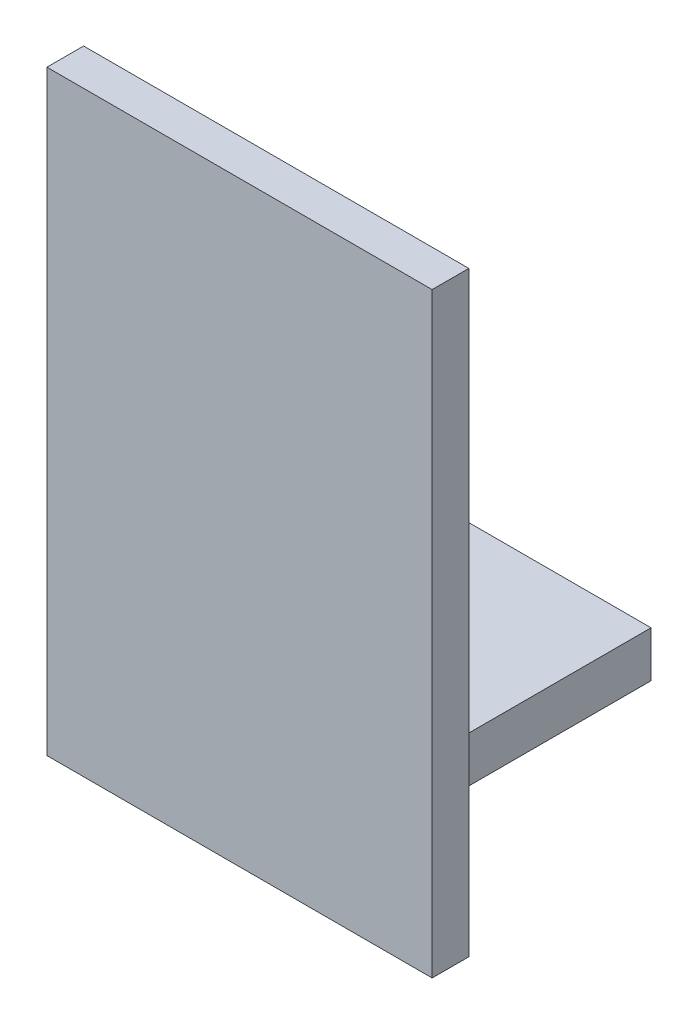
from build123d import *

# Parameters (mm, degrees)
EXTRUDE_1_DEPTH     = 42
SKETCH_3_W          = 16.132543854
SKETCH_3_H          = 36.374490106
CUT_EXTRUDE_1_DEPTH = 82.608823052


with BuildPart() as part:
    # Эскиз1 → Вытянуть1 (new body)
    with BuildSketch(Plane(origin=(0, 0, 0), x_dir=(0, 0, -1), z_dir=(1, 0, 0))):
        Polygon((0, 0), (0, 60), (-4, 60), (-4, -5), (36, -5), (36, 0), align=None)
    extrude(amount=-EXTRUDE_1_DEPTH)

    # Эскиз3 → Вырез-Вытянуть1 (cut, through all)
    with BuildSketch(Plane(origin=(0, 0, 0), x_dir=(1, 0, 0), z_dir=(0, 1, 0))):
        with Locations((-8.066271927, 18.187245053)):
            Rectangle(SKETCH_3_W, SKETCH_3_H)
    extrude(amount=-CUT_EXTRUDE_1_DEPTH, mode=Mode.SUBTRACT)


solid = part.part
